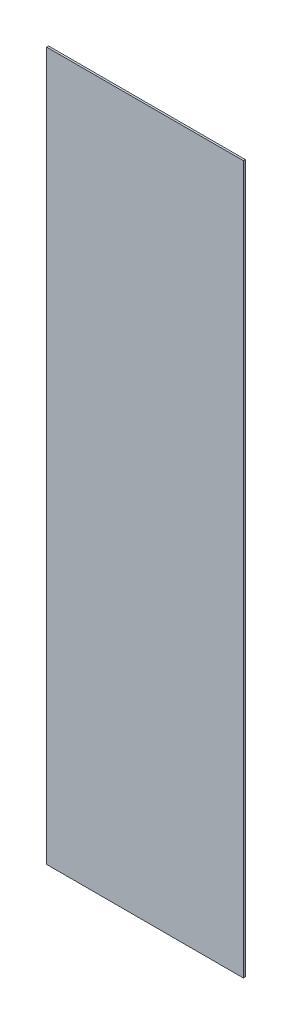
from build123d import *

# Parameters (mm, degrees)
SKETCH1_W           = 254
SKETCH1_H           = 914.4
BOSS_EXTRUDE1_DEPTH = 2.54


with BuildPart() as part:
    # Sketch1 → Boss-Extrude1 (new body)
    with BuildSketch(Plane.XY):
        with Locations((127, 457.2)):
            Rectangle(SKETCH1_W, SKETCH1_H)
    extrude(amount=BOSS_EXTRUDE1_DEPTH)


solid = part.part
